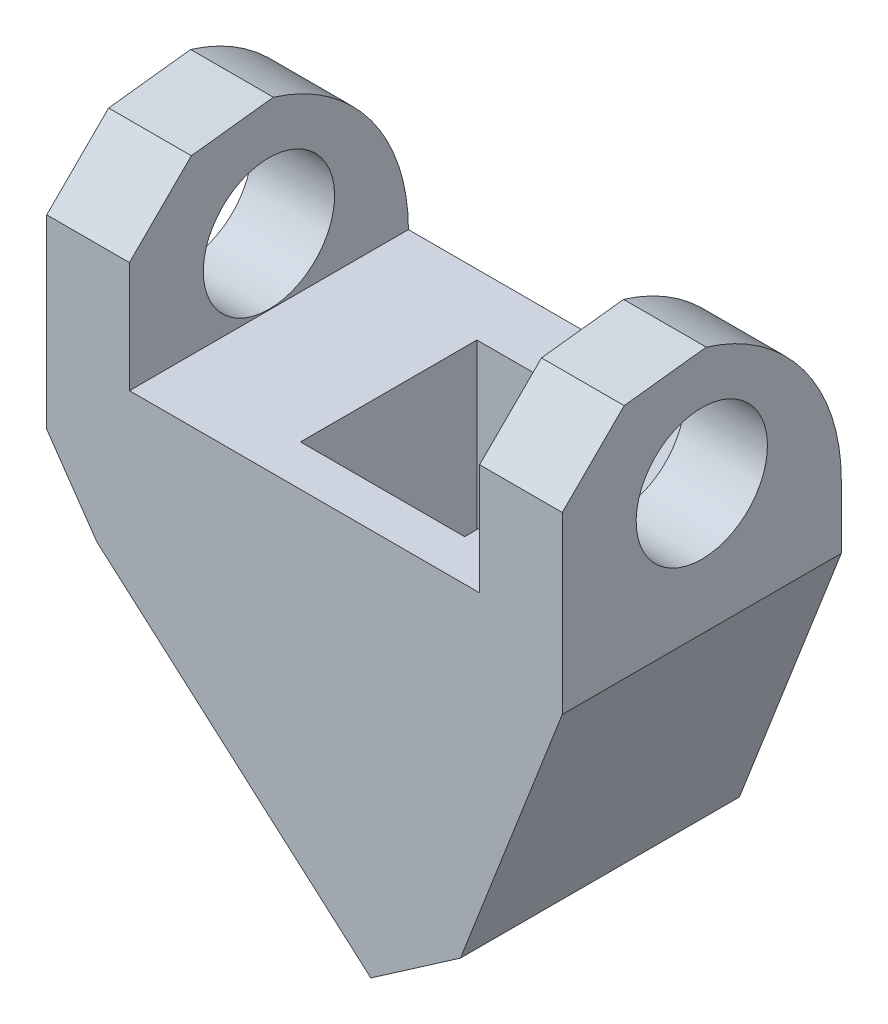
from build123d import *

# Parameters (mm, degrees)
BOSS_EXTRUDE1_DEPTH = 17
CUT_EXTRUDE1_DEPTH  = 31
SKETCH3_W           = 9.47
SKETCH3_H           = 10.75
CUT_EXTRUDE2_REACH  = 41.287
SKETCH6_W           = 10
SKETCH6_H           = 10.75
SKETCH7_R           = 4
CUT_EXTRUDE3_DEPTH  = 31


with BuildPart() as part:
    # Sketch1 → Boss-Extrude1 (new body)
    with BuildSketch(Plane.XY):
        Polygon((0, 0), (0, 11.1), (5.04, 11.1), (5.04, -3.9), (-1.16650456, -19.86), (-6.626200647, -23.639063196), (-23.319289693, -8.973826134), (-26.37555014, -4.558379149), (-26.37555014, 11.1), (-21.33555014, 11.1), (-21.33555014, 0), align=None)
    extrude(amount=BOSS_EXTRUDE1_DEPTH)

    # Sketch2 → Cut-Extrude1 (cut, symmetric)
    with BuildSketch(Plane.ZY):
        Polygon((8.228054067, 11.1), (17, 11.1), (17, 12.88110255), (0, 12.88110255), (0, 11.1), align=None)
        with BuildLine():
            ThreePointArc((0, 0), (2.28131811, 6.908525055), (8.228054067, 11.1))
            Line((8.228054067, 11.1), (0, 11.1))
            Line((0, 11.1), (0, 0))
        make_face()
        Polygon((13.228054067, 10.512247596), (17, 6.76), (17, 11.1), (8.228054067, 11.1), align=None)
    extrude(amount=CUT_EXTRUDE1_DEPTH, both=True, mode=Mode.SUBTRACT)

    # Cut-Sweep1: sweep along a path in Sketch5
    with BuildLine(Plane.XY.offset(7)) as cut_sweep1_path:
        Line((-11.079626433, -19.726633046), (-3.773757644, -14.201247879))
    # Sketch3 → Cut-Sweep1 (sweep, cut)
    with BuildSketch(Plane(origin=(-14.60747623, -16.627341271, 0), x_dir=(-0.7512641335035073, 0.6600016679609412, 0), z_dir=(-0.6600016679609412, -0.7512641335035074, 0))):
        with Locations((-1.868794251, -9.115)):
            Rectangle(SKETCH3_W, SKETCH3_H)
    sweep(path=cut_sweep1_path.line, mode=Mode.SUBTRACT)

    # Cut-Extrude2: up to this face of the body (flat: up to its plane)
    cut_extrude2_end = Plane(part.part.faces().sort_by_distance((-5.99334807, -18.223163907, 9.115))[0])
    # Sketch6 → Cut-Extrude2 (cut, up to the picked face)
    with BuildSketch(Plane(origin=(0, 0, 0), x_dir=(1, 0, 0), z_dir=(0, 1, 0)), mode=Mode.PRIVATE) as cut_extrude2_sk1:
        with Locations((-8.42, -9.115)):
            Rectangle(SKETCH6_W, SKETCH6_H)
    cut_extrude2_tool1 = split(extrude(cut_extrude2_sk1.sketch, amount=-CUT_EXTRUDE2_REACH, mode=Mode.PRIVATE), bisect_by=cut_extrude2_end, keep=Keep.BOTH, mode=Mode.PRIVATE)
    add(cut_extrude2_tool1.solids().sort_by(Axis((-8.42, 0, 9.115), (0, -1, 0)))[0], mode=Mode.SUBTRACT)

    # Sketch7 → Cut-Extrude3 (cut, symmetric)
    with BuildSketch(Plane.ZY.offset(10.66777507)):
        with Locations(Location((8.5, 4.041620851, 0), (0, 0, 270))):
            Circle(SKETCH7_R)
    extrude(amount=CUT_EXTRUDE3_DEPTH, both=True, mode=Mode.SUBTRACT)


solid = part.part
